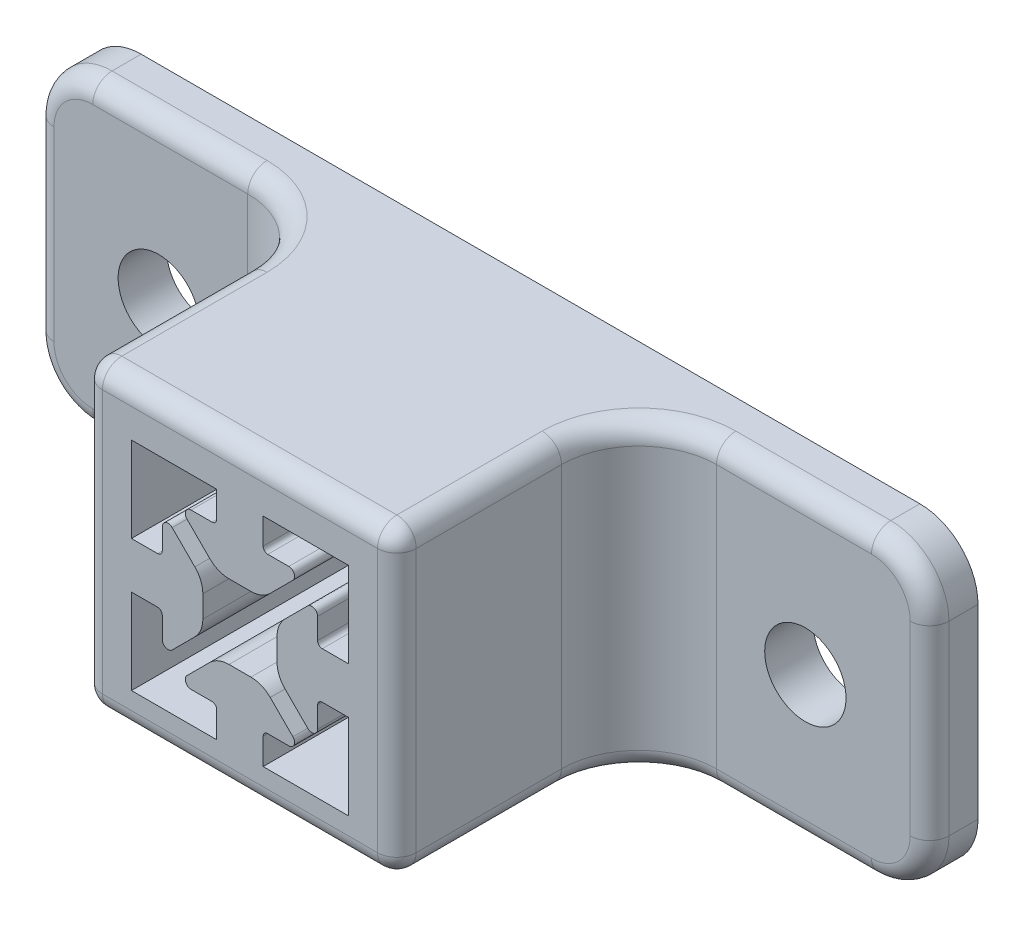
from build123d import *

# Parameters (mm, degrees)
SKETCH2_W           = 32.4
SKETCH2_H           = 31.2
BOSS_EXTRUDE1_DEPTH = 30
SKETCH3_W           = 5
SKETCH3_H           = 31.2
BOSS_EXTRUDE2_DEPTH = 30
SKETCH4_R           = 4.198469776
CUT_EXTRUDE1_DEPTH  = 15
FILLET6_R           = 8
FILLET7_R           = 6
FILLET8_R           = 2


with BuildPart() as part:
    # Sketch2 → Boss-Extrude1 (new body)
    with BuildSketch(Plane.XY.offset(-1358.940630238)):
        with Locations((-220.618842126, 630.6)):
            Rectangle(SKETCH2_W, SKETCH2_H)
        with BuildLine():
            Line((-218.223842126, 639.2), (-218.223842126, 638.500000763))
            ThreePointArc((-218.223842126, 638.500000763), (-218.083253443, 638.160589569), (-217.743842299, 638.020000763))
            Line((-217.743842299, 638.020000763), (-215.574720714, 638.019999981))
            ThreePointArc((-215.574720714, 638.019999981), (-215.020393169, 637.649609941), (-215.150456861, 636.995735913))
            Line((-215.150456861, 636.995735913), (-217.490233892, 634.655958882))
            ThreePointArc((-217.490233892, 634.655958882), (-218.405107733, 634.044659724), (-219.484275009, 633.830000005))
            Line((-219.484275009, 633.830000005), (-221.753409227, 633.83))
            ThreePointArc((-221.753409227, 633.83), (-222.83257651, 634.044659717), (-223.747450356, 634.655958877))
            Line((-223.747450356, 634.655958877), (-226.087227386, 636.995735907))
            ThreePointArc((-226.087227386, 636.995735907), (-226.217291078, 637.649609934), (-225.662963535, 638.019999975))
            Line((-225.662963535, 638.019999975), (-223.493841952, 638.020000763))
            ThreePointArc((-223.493841952, 638.020000763), (-223.15443081, 638.16058957), (-223.013842126, 638.500000763))
            Line((-223.013842126, 638.500000763), (-223.013842126, 639.2))
            Line((-223.013842126, 639.2), (-223.013842126, 641.2))
            Line((-223.013842126, 641.2), (-231.818842126, 641.2))
            Line((-231.818842126, 641.2), (-231.818842126, 632.395))
            Line((-231.818842126, 632.395), (-229.818842126, 632.395))
            Line((-229.818842126, 632.395), (-229.118842889, 632.395))
            ThreePointArc((-229.118842889, 632.395), (-228.779431696, 632.535588684), (-228.638842889, 632.874999827))
            Line((-228.638842889, 632.874999827), (-228.638842108, 635.044121413))
            ThreePointArc((-228.638842108, 635.044121413), (-228.268452067, 635.598448957), (-227.614578039, 635.468385265))
            Line((-227.614578039, 635.468385265), (-225.274801008, 633.128608235))
            ThreePointArc((-225.274801008, 633.128608235), (-224.663501851, 632.213734394), (-224.448842131, 631.134567117))
            Line((-224.448842131, 631.134567117), (-224.448842127, 628.865432899))
            ThreePointArc((-224.448842127, 628.865432899), (-224.663501844, 627.786265617), (-225.274801004, 626.87139177))
            Line((-225.274801004, 626.87139177), (-227.614578033, 624.531614741))
            ThreePointArc((-227.614578033, 624.531614741), (-228.268452061, 624.401551048), (-228.638842102, 624.955878592))
            Line((-228.638842102, 624.955878592), (-228.638842889, 627.125000174))
            ThreePointArc((-228.638842889, 627.125000174), (-228.779431696, 627.464411317), (-229.118842889, 627.605))
            Line((-229.118842889, 627.605), (-229.818842126, 627.605))
            Line((-229.818842126, 627.605), (-231.818842126, 627.605))
            Line((-231.818842126, 627.605), (-231.818842126, 618.8))
            Line((-231.818842126, 618.8), (-223.013842126, 618.8))
            Line((-223.013842126, 618.8), (-223.013842126, 620.8))
            Line((-223.013842126, 620.8), (-223.013842126, 621.499999237))
            ThreePointArc((-223.013842126, 621.499999237), (-223.15443081, 621.839410431), (-223.493841954, 621.979999237))
            Line((-223.493841954, 621.979999237), (-225.662963539, 621.980000019))
            ThreePointArc((-225.662963539, 621.980000019), (-226.217291084, 622.350390059), (-226.087227392, 623.004264087))
            Line((-226.087227392, 623.004264087), (-223.747450361, 625.344041118))
            ThreePointArc((-223.747450361, 625.344041118), (-222.83257652, 625.955340276), (-221.753409244, 626.169999995))
            Line((-221.753409244, 626.169999995), (-219.484275025, 626.17))
            ThreePointArc((-219.484275025, 626.17), (-218.405107743, 625.955340283), (-217.490233897, 625.344041123))
            Line((-217.490233897, 625.344041123), (-215.150456867, 623.004264093))
            ThreePointArc((-215.150456867, 623.004264093), (-215.020393175, 622.350390066), (-215.574720718, 621.980000025))
            Line((-215.574720718, 621.980000025), (-217.743842301, 621.979999237))
            ThreePointArc((-217.743842301, 621.979999237), (-218.083253443, 621.83941043), (-218.223842126, 621.499999237))
            Line((-218.223842126, 621.499999237), (-218.223842126, 620.8))
            Line((-218.223842126, 620.8), (-218.223842126, 618.8))
            Line((-218.223842126, 618.8), (-209.418842126, 618.8))
            Line((-209.418842126, 618.8), (-209.418842126, 627.605))
            Line((-209.418842126, 627.605), (-211.418842126, 627.605))
            Line((-211.418842126, 627.605), (-212.118841364, 627.605))
            ThreePointArc((-212.118841364, 627.605), (-212.458252557, 627.464411316), (-212.598841364, 627.125000173))
            Line((-212.598841364, 627.125000173), (-212.598842145, 624.955878587))
            ThreePointArc((-212.598842145, 624.955878587), (-212.969232185, 624.401551043), (-213.623106214, 624.531614735))
            Line((-213.623106214, 624.531614735), (-215.962883245, 626.871391765))
            ThreePointArc((-215.962883245, 626.871391765), (-216.574182402, 627.786265606), (-216.788842122, 628.865432883))
            Line((-216.788842122, 628.865432883), (-216.788842126, 631.134567101))
            ThreePointArc((-216.788842126, 631.134567101), (-216.574182409, 632.213734383), (-215.962883249, 633.12860823))
            Line((-215.962883249, 633.12860823), (-213.62310622, 635.468385259))
            ThreePointArc((-213.62310622, 635.468385259), (-212.969232192, 635.598448952), (-212.598842151, 635.044121408))
            Line((-212.598842151, 635.044121408), (-212.598841364, 632.874999826))
            ThreePointArc((-212.598841364, 632.874999826), (-212.458252557, 632.535588683), (-212.118841364, 632.395))
            Line((-212.118841364, 632.395), (-211.418842126, 632.395))
            Line((-211.418842126, 632.395), (-209.418842126, 632.395))
            Line((-209.418842126, 632.395), (-209.418842126, 641.2))
            Line((-209.418842126, 641.2), (-218.223842126, 641.2))
            Line((-218.223842126, 641.2), (-218.223842126, 639.2))
        make_face(mode=Mode.SUBTRACT)
    extrude(amount=BOSS_EXTRUDE1_DEPTH)

    # Sketch3 → Boss-Extrude2 (add)
    with BuildSketch(Plane(origin=(-204.418842126, 0, 0), x_dir=(0, 0, -1), z_dir=(1, 0, 0))):
        with Locations((1356.440630238, 630.6)):
            Rectangle(SKETCH3_W, SKETCH3_H)
    boss_extrude2 = extrude(amount=BOSS_EXTRUDE2_DEPTH)

    # Sketch4 → Cut-Extrude1 (cut, symmetric)
    with BuildSketch(Plane.XY.offset(-1353.940630238)):
        with Locations((-187.243842126, 630)):
            Circle(SKETCH4_R)
    cut_extrude1 = extrude(amount=CUT_EXTRUDE1_DEPTH, both=True, mode=Mode.SUBTRACT)

    # Mirror6: Boss-Extrude2 across plane
    add(boss_extrude2.mirror(Plane(origin=(-220.618842126, 0, 0), x_dir=(0, 0, 1), z_dir=(1, 0, 0))))

    # Mirror9: Cut-Extrude1 across plane
    add(cut_extrude1.mirror(Plane(origin=(-220.618842126, 0, 0), x_dir=(0, 0, 1), z_dir=(1, 0, 0))), mode=Mode.SUBTRACT)

    # Fillet6
    fillet6_edges = [part.edges().sort_by_distance(p)[0] for p in [
        (-204.418842126, 630.6, -1353.940630238),
        (-236.818842126, 630.6, -1353.940630238),
    ]]
    fillet(fillet6_edges, radius=FILLET6_R)

    # Fillet7
    fillet7_edges = [part.edges().sort_by_distance(p)[0] for p in [
        (-174.418842126, 646.2, -1356.440630238),
        (-174.418842126, 615, -1356.440630238),
        (-266.818842126, 615, -1356.440630238),
        (-266.818842126, 646.2, -1356.440630238),
    ]]
    fillet(fillet7_edges, radius=FILLET7_R)

    # Fillet8
    fillet8_edges = [part.edges().sort_by_distance(p)[0] for p in [
        (-204.418842126, 630.6, -1328.940630238),
        (-220.618842126, 646.2, -1328.940630238),
        (-239.161987877, 615, -1351.597484488),
        (-239.161987877, 646.2, -1351.597484488),
        (-202.075696376, 615, -1351.597484488),
        (-202.075696376, 646.2, -1351.597484488),
        (-188.418842126, 615, -1353.940630238),
        (-252.818842126, 615, -1353.940630238),
        (-266.818842126, 630.6, -1353.940630238),
        (-252.818842126, 646.2, -1353.940630238),
        (-265.061482814, 644.442640687, -1353.940630238),
        (-265.061482814, 616.757359313, -1353.940630238),
        (-188.418842126, 646.2, -1353.940630238),
        (-174.418842126, 630.6, -1353.940630238),
        (-176.176201439, 644.442640687, -1353.940630238),
        (-176.176201439, 616.757359313, -1353.940630238),
        (-236.818842126, 630.6, -1328.940630238),
        (-236.818842126, 646.2, -1337.440630238),
        (-204.418842126, 646.2, -1337.440630238),
        (-204.418842126, 615, -1337.440630238),
        (-236.818842126, 615, -1337.440630238),
        (-220.618842126, 615, -1328.940630238),
    ]]
    fillet(fillet8_edges, radius=FILLET8_R)


solid = part.part
